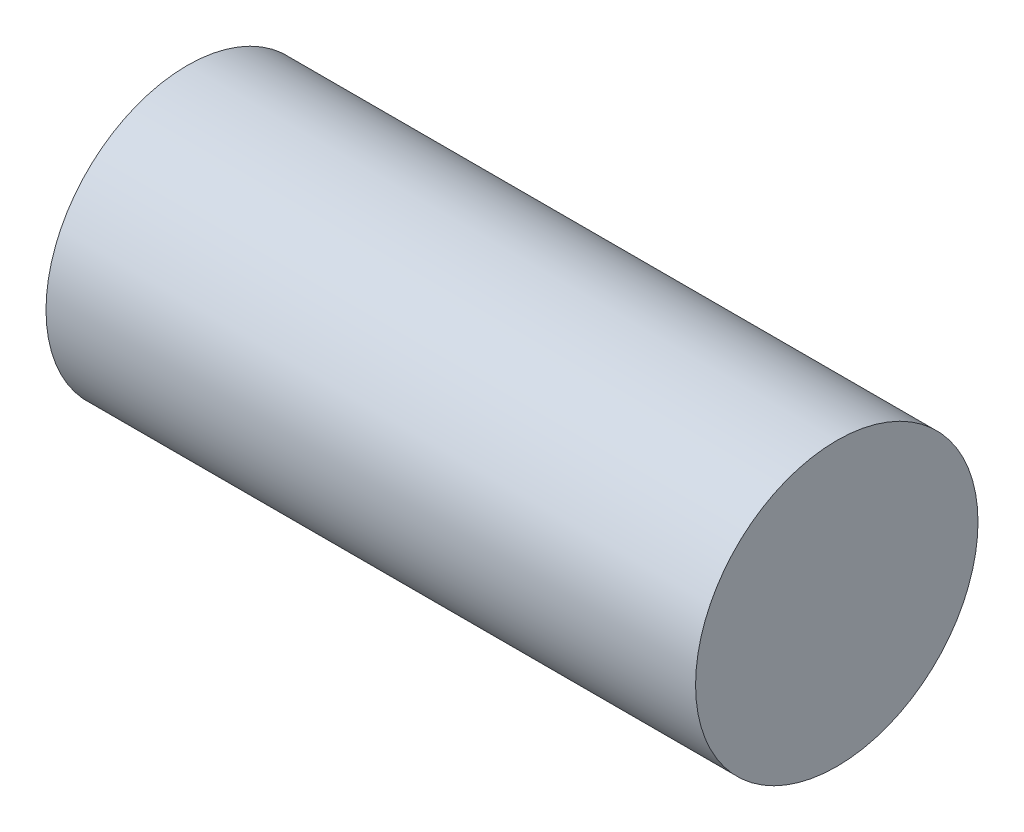
from build123d import *

# Parameters (mm, degrees)
SKETCH1_W = 46
SKETCH1_H = 10


with BuildPart() as part:
    # Sketch1 → Revolve1 (revolve)
    with BuildSketch(Plane.XY, mode=Mode.PRIVATE) as revolve1_sk:
        with Locations((0, 5)):
            Rectangle(SKETCH1_W, SKETCH1_H)
    revolve(revolve1_sk.sketch.rotate(Axis((-30.105691057, 0, 0), (1, 0, 0)), 180), axis=Axis((-30.105691057, 0, 0), (1, 0, 0)))


solid = part.part
